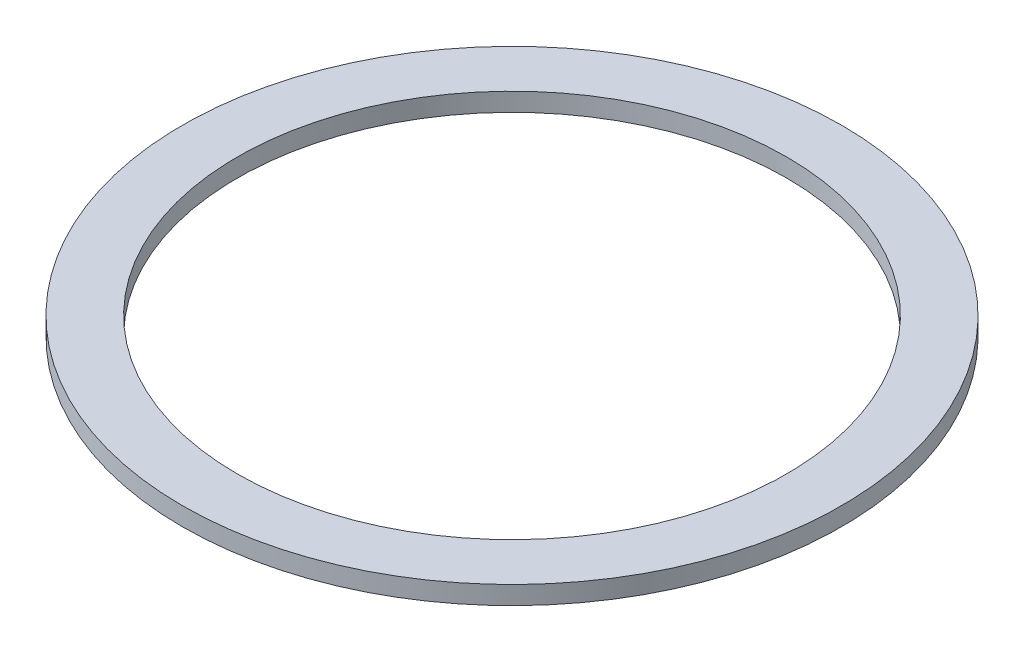
from build123d import *

# Parameters (mm, degrees)
SKETCH1_R           = 180
SKETCH1_R_2         = 150
BOSS_EXTRUDE1_DEPTH = 5


with BuildPart() as part:
    # Sketch1 → Boss-Extrude1 (new, symmetric)
    with BuildSketch(Plane(origin=(0, 0, 0), x_dir=(1, 0, 0), z_dir=(0, 1, 0))):
        with Locations(Location((0, 0, 0), (0, 0, 270))):
            Circle(SKETCH1_R)
        with Locations(Location((0, 0, 0), (0, 0, 270))):
            Circle(SKETCH1_R_2, mode=Mode.SUBTRACT)
    extrude(amount=BOSS_EXTRUDE1_DEPTH, both=True)


solid = part.part
